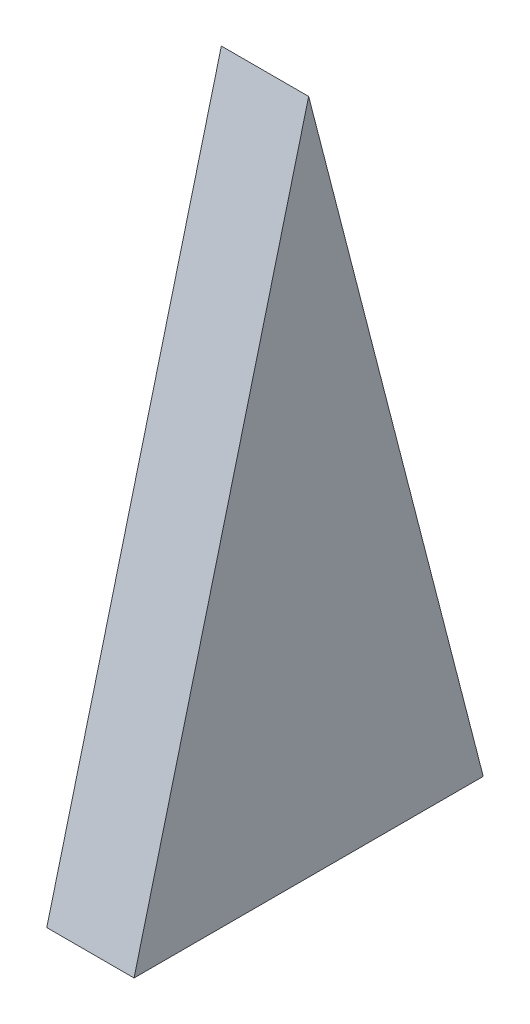
from build123d import *

# Parameters (mm, degrees)
BOSS_EXTRU_1_DEPTH = 10


with BuildPart() as part:
    # Esquisse2 → Boss.-Extru.1 (new body)
    with BuildSketch(Plane(origin=(0, 0, 0), x_dir=(0, 0, -1), z_dir=(1, 0, 0))):
        Polygon((0, 77.459666924), (-20, 0), (20, 0), align=None)
    extrude(amount=-BOSS_EXTRU_1_DEPTH)


solid = part.part
